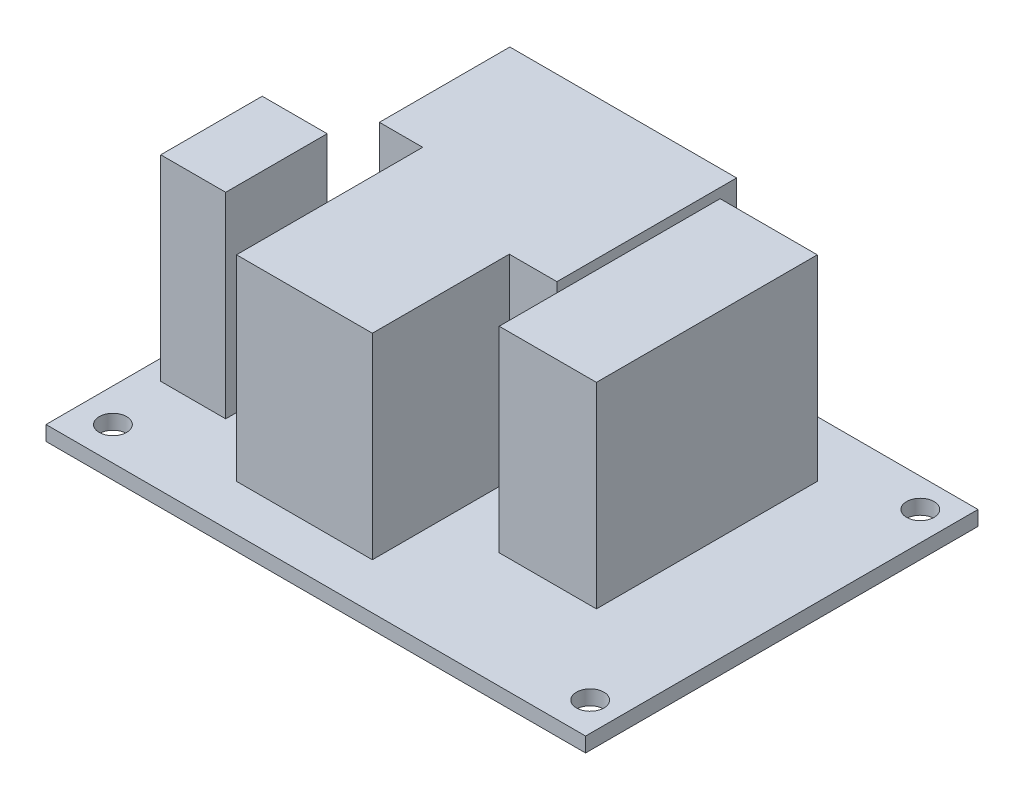
from build123d import *

# Parameters (mm, degrees)
SKETCH1_W           = 55
SKETCH1_H           = 40
SKETCH1_R           = 1.4
BOSS_EXTRUDE1_DEPTH = 1.5
SKETCH2_W           = 9.907742448
SKETCH2_H           = 22.517169438
SKETCH2_W_2         = 6.62013717
SKETCH2_H_2         = 10.343964327
BOSS_EXTRUDE2_DEPTH = 20


with BuildPart() as part:
    # Sketch1 → Boss-Extrude1 (new body)
    with BuildSketch(Plane(origin=(0, 0, 0), x_dir=(1, 0, 0), z_dir=(0, 1, 0))):
        Rectangle(SKETCH1_W, SKETCH1_H)
        with Locations(Location((-24.09, 17.06, 0), (0, 0, 270))):
            Circle(SKETCH1_R, mode=Mode.SUBTRACT)
        with Locations(Location((-24.09, -16.59, 0), (0, 0, 270))):
            Circle(SKETCH1_R, mode=Mode.SUBTRACT)
        with Locations(Location((24.56, -16.59, 0), (0, 0, 270))):
            Circle(SKETCH1_R, mode=Mode.SUBTRACT)
        with Locations(Location((24.56, 17.06, 0), (0, 0, 270))):
            Circle(SKETCH1_R, mode=Mode.SUBTRACT)
    extrude(amount=BOSS_EXTRUDE1_DEPTH)

    # Sketch2 → Boss-Extrude2 (add)
    with BuildSketch(Plane(origin=(0, 1.5, 0), x_dir=(1, 0, 0), z_dir=(0, 1, 0))):
        with Locations((11.877828391, 3.030915981)):
            Rectangle(SKETCH2_W, SKETCH2_H)
        Polygon((5.930539548, 16.964101497), (-17.184772736, 16.964101497), (-17.184772736, 3.668659348), (-12.771347956, 3.668659348), (-12.771347956, -15.309067205), (1.07577229, -15.309067205), (1.07577229, -1.351611339), (5.930539548, -1.351611339), align=None)
        with Locations((-22.149875613, -5.171982164)):
            Rectangle(SKETCH2_W_2, SKETCH2_H_2)
    extrude(amount=BOSS_EXTRUDE2_DEPTH)


solid = part.part
